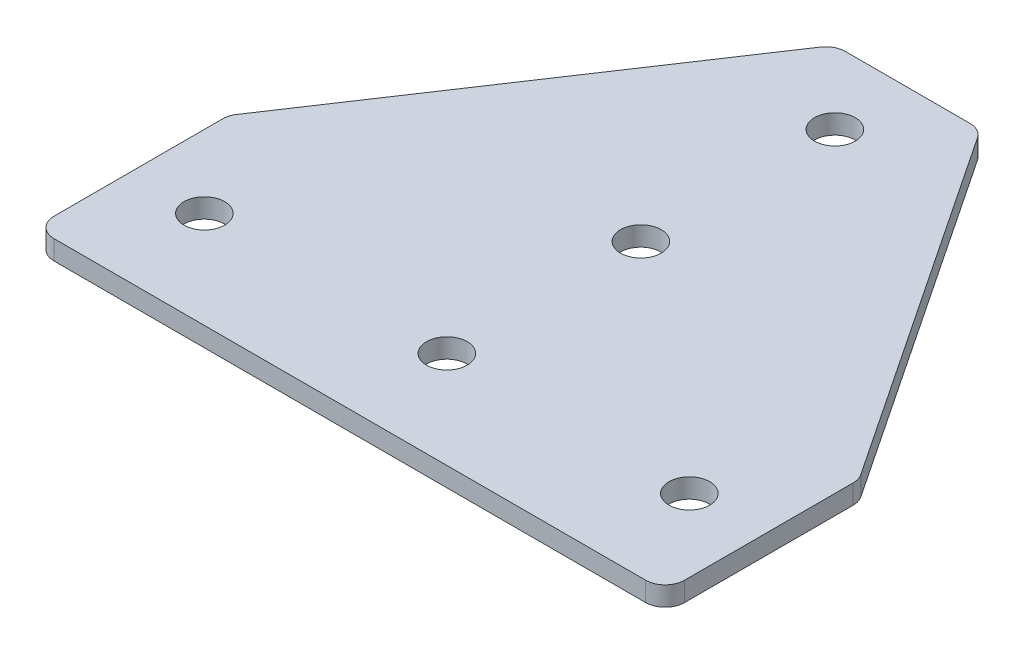
from build123d import *

# Parameters (mm, degrees)
SKETCH_1_R      = 2.1
EXTRUDE_1_DEPTH = 2
FILLET_1_R      = 2


with BuildPart() as part:
    # ｽｹｯﾁ1 → ﾎﾞｽ - 押し出し1 (new body)
    with BuildSketch(Plane(origin=(0, 0, 0), x_dir=(1, 0, 0), z_dir=(0, 1, 0))):
        Polygon((0, 0), (65, 0), (65, 20), (40, 57.5), (25, 57.5), (0, 20), align=None)
        with Locations(Location((7.5, 10, 0), (0, 0, 270))):
            Circle(SKETCH_1_R, mode=Mode.SUBTRACT)
        with Locations(Location((57.5, 10, 0), (0, 0, 90))):
            Circle(SKETCH_1_R, mode=Mode.SUBTRACT)
        with Locations(Location((32.5, 10, 0), (0, 0, 270))):
            Circle(SKETCH_1_R, mode=Mode.SUBTRACT)
        with Locations(Location((32.5, 50, 0), (0, 0, 270))):
            Circle(SKETCH_1_R, mode=Mode.SUBTRACT)
        with Locations(Location((32.5, 30, 0), (0, 0, 270))):
            Circle(SKETCH_1_R, mode=Mode.SUBTRACT)
    extrude(amount=EXTRUDE_1_DEPTH)

    # ﾌｨﾚｯﾄ1
    fillet_1_edges = [part.edges().sort_by_distance(p)[0] for p in [
        (0, 1, -20),
        (25, 1, -57.5),
        (40, 1, -57.5),
        (65, 1, -20),
        (65, 1, 0),
        (0, 1, 0),
    ]]
    fillet(fillet_1_edges, radius=FILLET_1_R)


solid = part.part
